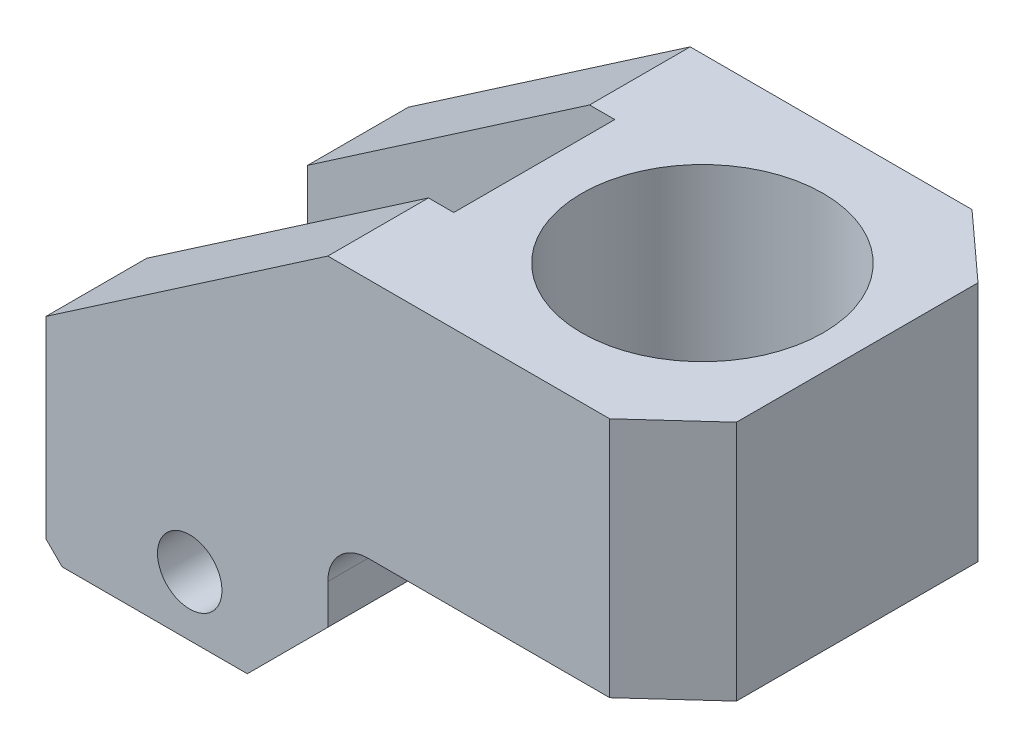
from build123d import *

# Parameters (mm, degrees)
EXTRUDE_1_DEPTH       = 30
SKETCH_2_R            = 15
CUT_EXTRUDE_2_DEPTH   = 45.532745299
EXTRUDE_3_DEPTH       = 45
CUT_EXTRUDE_START     = 70
SKETCH_3_W            = 44.656689001
SKETCH_3_H            = 20
CUT_EXTRUDE_1_DEPTH   = 130
SKETCH_7_R            = 3.999999997
CUT_EXTRUDE_2_2_DEPTH = 81.051544881
FILLET_1_R            = 5
CHAMFER_5_SIZE        = 2
CHAMFER_6_SIZE        = 10


with BuildPart() as part:
    # Эскиз1 → Вытянуть1 (new body)
    with BuildSketch(Plane(origin=(0, 0, 0), x_dir=(1, 0, 0), z_dir=(0, 1, 0))):
        Polygon((-24.019063342, 22.5), (10.980936658, 22.5), (19.22346273, 15), (19.22346273, -15), (10.980936658, -22.5), (-24.019063342, -22.5), align=None)
    extrude(amount=EXTRUDE_1_DEPTH)

    # Эскиз2 → Cut-Extrude 2 (cut, through all)
    with BuildSketch(Plane(origin=(0, 30, 0), x_dir=(1, 0, 0), z_dir=(0, 1, 0))):
        with Locations(Location((0, 0, 0), (0, 0, 270))):
            Circle(SKETCH_2_R)
    extrude(amount=-CUT_EXTRUDE_2_DEPTH, mode=Mode.SUBTRACT)

    # Эскиз6 → Вытянуть3 (add)
    with BuildSketch(Plane(origin=(0, 0, -22.5), x_dir=(-1, 0, 0), z_dir=(0, 0, -1))):
        Polygon((24.019063342, -19.927530698), (24.019063342, 30), (59.019063342, 6.012561534), (59.019063342, -19.927530698), align=None)
    extrude(amount=-EXTRUDE_3_DEPTH)

    # Эскиз3 → Вырез-Вытянуть1 (cut)
    with BuildSketch(Plane(origin=(0, 30, 0), x_dir=(1, 0, 0), z_dir=(0, 1, 0)).offset(CUT_EXTRUDE_START)):
        with Locations((-43.210774099, 0)):
            Rectangle(SKETCH_3_W, SKETCH_3_H)
    extrude(amount=-CUT_EXTRUDE_1_DEPTH, mode=Mode.SUBTRACT)

    # Эскиз7 → Cut-Extrude 2 2 (cut, through all)
    with BuildSketch(Plane(origin=(0, 0, -22.5), x_dir=(-1, 0, 0), z_dir=(0, 0, -1))):
        with Locations((41.170494395, -12.547441244)):
            Circle(SKETCH_7_R)
    extrude(amount=-CUT_EXTRUDE_2_2_DEPTH, mode=Mode.SUBTRACT)

    # Скругление1
    fillet_1_edges = [part.edges().sort_by_distance(p)[0] for p in [
        (-24.019063342, 0, -16.25),
    ]]
    fillet(fillet_1_edges, radius=FILLET_1_R)

    # Фаска5
    chamfer_5_edges = [part.edges().sort_by_distance(p)[0] for p in [
        (-59.019063342, -19.927530698, 16.25),
        (-59.019063342, -19.927530698, -16.25),
    ]]
    chamfer(chamfer_5_edges, length=CHAMFER_5_SIZE)

    # Фаска6
    chamfer_6_edges = [part.edges().sort_by_distance(p)[0] for p in [
        (-24.019063342, -19.927530698, 16.25),
        (-24.019063342, -19.927530698, -16.25),
    ]]
    chamfer(chamfer_6_edges, length=CHAMFER_6_SIZE)


solid = part.part
